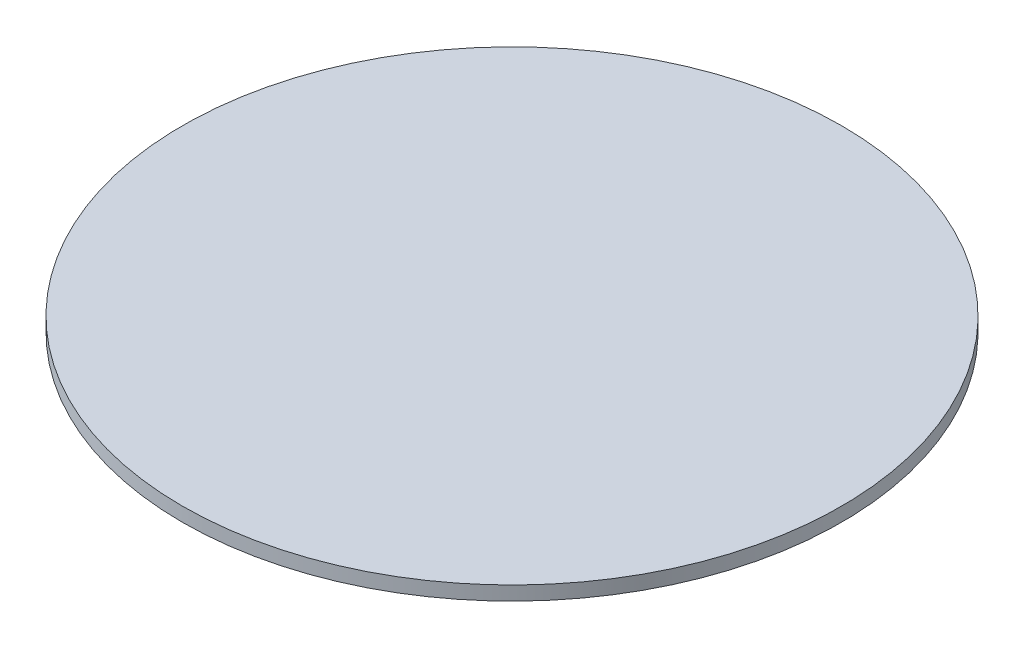
from build123d import *

# Parameters (mm, degrees)
SKETCH1_R           = 4
BOSS_EXTRUDE1_DEPTH = 0.17


with BuildPart() as part:
    # Sketch1 → Boss-Extrude1 (new body)
    with BuildSketch(Plane(origin=(0, 0, 0), x_dir=(1, 0, 0), z_dir=(0, 1, 0))):
        with Locations(Location((0, 0, 0), (0, 0, 270))):
            Circle(SKETCH1_R)
    extrude(amount=BOSS_EXTRUDE1_DEPTH)


solid = part.part
